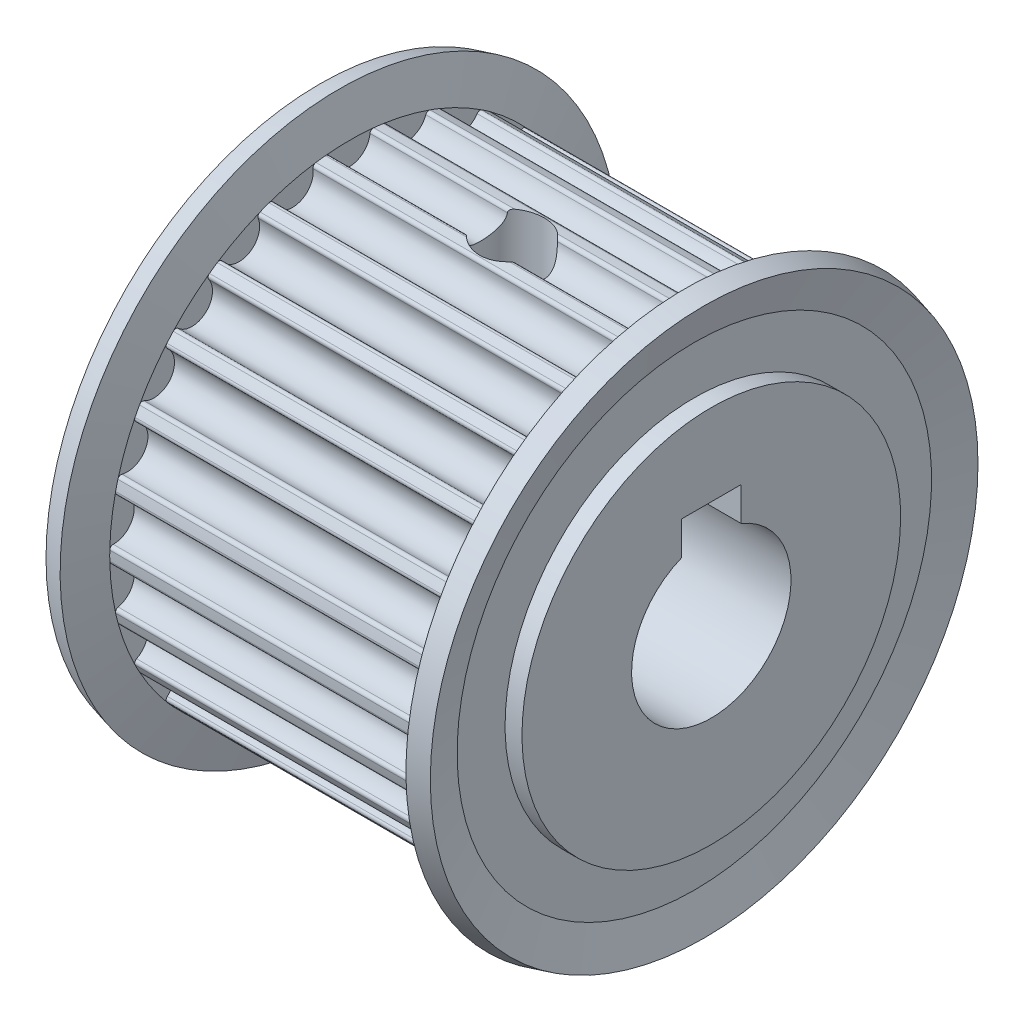
from build123d import *

# Parameters (mm, degrees)
CUT_EXTRUDE1_DEPTH       = 8.15
CUT_EXTRUDE1_DEPTH_BACK  = 8.15
CUT_EXTRUDE2_DEPTH       = 8.15
CUT_EXTRUDE2_DEPTH_BACK  = 8.15
CUT_EXTRUDE3_DEPTH       = 8.15
CUT_EXTRUDE3_DEPTH_BACK  = 8.15
CUT_EXTRUDE4_DEPTH       = 8.15
CUT_EXTRUDE4_DEPTH_BACK  = 8.15
CUT_EXTRUDE5_DEPTH       = 8.15
CUT_EXTRUDE5_DEPTH_BACK  = 8.15
CUT_EXTRUDE6_DEPTH       = 8.15
CUT_EXTRUDE6_DEPTH_BACK  = 8.15
CUT_EXTRUDE7_DEPTH       = 8.15
CUT_EXTRUDE7_DEPTH_BACK  = 8.15
CUT_EXTRUDE8_DEPTH       = 8.15
CUT_EXTRUDE8_DEPTH_BACK  = 8.15
CUT_EXTRUDE9_DEPTH       = 8.15
CUT_EXTRUDE9_DEPTH_BACK  = 8.15
CUT_EXTRUDE10_DEPTH      = 8.15
CUT_EXTRUDE10_DEPTH_BACK = 8.15
CUT_EXTRUDE11_DEPTH      = 8.15
CUT_EXTRUDE11_DEPTH_BACK = 8.15
CUT_EXTRUDE12_DEPTH      = 8.15
CUT_EXTRUDE12_DEPTH_BACK = 8.15
CUT_EXTRUDE13_DEPTH      = 8.15
CUT_EXTRUDE13_DEPTH_BACK = 8.15
CUT_EXTRUDE14_DEPTH      = 8.15
CUT_EXTRUDE14_DEPTH_BACK = 8.15
CUT_EXTRUDE15_DEPTH      = 8.15
CUT_EXTRUDE15_DEPTH_BACK = 8.15
CUT_EXTRUDE16_DEPTH      = 8.15
CUT_EXTRUDE16_DEPTH_BACK = 8.15
CUT_EXTRUDE17_DEPTH      = 8.15
CUT_EXTRUDE17_DEPTH_BACK = 8.15
CUT_EXTRUDE18_DEPTH      = 8.15
CUT_EXTRUDE18_DEPTH_BACK = 8.15
CUT_EXTRUDE19_DEPTH      = 8.15
CUT_EXTRUDE19_DEPTH_BACK = 8.15
CUT_EXTRUDE20_DEPTH      = 8.15
CUT_EXTRUDE20_DEPTH_BACK = 8.15
CUT_EXTRUDE21_DEPTH      = 8.15
CUT_EXTRUDE21_DEPTH_BACK = 8.15
CUT_EXTRUDE22_DEPTH      = 8.15
CUT_EXTRUDE22_DEPTH_BACK = 8.15
CUT_EXTRUDE23_DEPTH      = 8.15
CUT_EXTRUDE23_DEPTH_BACK = 8.15
CUT_EXTRUDE24_DEPTH      = 8.15
CUT_EXTRUDE24_DEPTH_BACK = 8.15
CUT_EXTRUDE25_DEPTH      = 8.15
CUT_EXTRUDE25_DEPTH_BACK = 8.15
CUT_EXTRUDE26_DEPTH      = 8.15
CUT_EXTRUDE26_DEPTH_BACK = 8.15
SKETCH28_W               = 20
SKETCH28_H               = 4
SKETCH29_W               = 1.621
SKETCH29_H               = 12.035
SKETCH31_W               = 3
SKETCH31_H               = 5.4
CUT_EXTRUDE27_DEPTH      = 20


with BuildPart() as part:
    # Sketch1 → Revolve1 (revolve)
    with BuildSketch(Plane.XY, mode=Mode.PRIVATE) as revolve1_sk:
        Polygon((0, 0), (0, 9.5), (0.85, 9.5), (0.85, 11.903347502), (0.357554011, 13.741180955), (1.323479837, 14), (1.85, 12.035), (18.15, 12.035), (18.676520163, 14), (19.642445989, 13.741180955), (19.15, 11.903347502), (19.15, 9.5), (20, 9.5), (20, 0), align=None)
    revolve(revolve1_sk.sketch.rotate(Axis((20, 0, 0), (-1, 0, 0)), 180), axis=Axis((20, 0, 0), (-1, 0, 0)))

    # Sketch2 → Cut-Extrude1 (cut, two sides: drawn at the far end of the back side and taken through both)
    with BuildSketch(Plane(origin=(10, 0, 0), x_dir=(0, 0, -1), z_dir=(1, 0, 0)).offset(-CUT_EXTRUDE1_DEPTH_BACK)):
        with BuildLine():
            Line((-1.249308054, 12.3519818), (-1.211069064, 11.97391067))
            ThreePointArc((-1.211069064, 11.97391067), (-1.086431486, 11.936444223), (-1.024817519, 11.821805749))
            ThreePointArc((-1.024817519, 11.821805749), (1e-09, 10.895), (1.024817519, 11.821805751))
            ThreePointArc((1.024817519, 11.821805751), (1.086431486, 11.936444223), (1.211069064, 11.97391067))
            Line((1.211069064, 11.97391067), (1.249308054, 12.3519818))
            ThreePointArc((1.249308054, 12.3519818), (0, 12.415), (-1.249308054, 12.3519818))
        make_face()
    extrude(amount=CUT_EXTRUDE1_DEPTH + CUT_EXTRUDE1_DEPTH_BACK, mode=Mode.SUBTRACT)

    # Sketch3 → Cut-Extrude2 (cut, two sides: drawn at the far end of the back side and taken through both)
    with BuildSketch(Plane(origin=(10, 0, 0), x_dir=(0, 0, -1), z_dir=(1, 0, 0)).offset(-CUT_EXTRUDE2_DEPTH_BACK)):
        with BuildLine():
            Line((-4.169028162, 11.694076671), (-4.041421984, 11.33614279))
            ThreePointArc((-4.041421984, 11.33614279), (-3.91143984, 11.329592774), (-3.82418148, 11.233030674))
            ThreePointArc((-3.82418148, 11.233030674), (-2.607344162, 10.578411101), (-1.834105112, 11.723540446))
            ThreePointArc((-1.834105112, 11.723540446), (-1.801716317, 11.84959292), (-1.689666788, 11.915798385))
            Line((-1.689666788, 11.915798385), (-1.743017297, 12.292034644))
            ThreePointArc((-1.743017297, 12.292034644), (-2.971103972, 12.054242663), (-4.169028162, 11.694076671))
        make_face()
    extrude(amount=CUT_EXTRUDE2_DEPTH + CUT_EXTRUDE2_DEPTH_BACK, mode=Mode.SUBTRACT)

    # Sketch4 → Cut-Extrude3 (cut, two sides: drawn at the far end of the back side and taken through both)
    with BuildSketch(Plane(origin=(10, 0, 0), x_dir=(0, 0, -1), z_dir=(1, 0, 0)).offset(-CUT_EXTRUDE3_DEPTH_BACK)):
        with BuildLine():
            Line((-6.846459507, 10.356554312), (-6.636902148, 10.039559496))
            ThreePointArc((-6.636902148, 10.039559496), (-6.509129527, 10.064306575), (-6.401297914, 9.991432686))
            ThreePointArc((-6.401297914, 9.991432686), (-5.063158959, 9.6470434), (-4.58643622, 10.943945584))
            ThreePointArc((-4.58643622, 10.943945584), (-4.585154916, 11.074086349), (-4.492205348, 11.16518321))
            Line((-4.492205348, 11.16518321), (-4.634044819, 11.517719115))
            ThreePointArc((-4.634044819, 11.517719115), (-5.769538181, 10.992936558), (-6.846459507, 10.356554312))
        make_face()
    extrude(amount=CUT_EXTRUDE3_DEPTH + CUT_EXTRUDE3_DEPTH_BACK, mode=Mode.SUBTRACT)

    # Sketch5 → Cut-Extrude4 (cut, two sides: drawn at the far end of the back side and taken through both)
    with BuildSketch(Plane(origin=(10, 0, 0), x_dir=(0, 0, -1), z_dir=(1, 0, 0)).offset(-CUT_EXTRUDE4_DEPTH_BACK)):
        with BuildLine():
            Line((-9.125999512, 8.417146661), (-8.846669684, 8.159513497))
            ThreePointArc((-8.846669684, 8.159513497), (-8.728532267, 8.214119461), (-8.606394181, 8.169168949))
            ThreePointArc((-8.606394181, 8.169168949), (-7.224721361, 8.155024602), (-7.072220327, 9.528328384))
            ThreePointArc((-7.072220327, 9.528328384), (-7.102120978, 9.654994131), (-7.033673262, 9.765688171))
            Line((-7.033673262, 9.765688171), (-7.2557585, 10.074035616))
            ThreePointArc((-7.2557585, 10.074035616), (-8.232667802, 9.292760939), (-9.125999512, 8.417146661))
        make_face()
    extrude(amount=CUT_EXTRUDE4_DEPTH + CUT_EXTRUDE4_DEPTH_BACK, mode=Mode.SUBTRACT)

    # Sketch6 → Cut-Extrude5 (cut, two sides: drawn at the far end of the back side and taken through both)
    with BuildSketch(Plane(origin=(10, 0, 0), x_dir=(0, 0, -1), z_dir=(1, 0, 0)).offset(-CUT_EXTRUDE5_DEPTH_BACK)):
        with BuildLine():
            Line((-10.875169596, 5.988565041), (-10.542300934, 5.805266232))
            ThreePointArc((-10.542300934, 5.805266232), (-10.440664438, 5.88655758), (-10.311318101, 5.872142805))
            ThreePointArc((-10.311318101, 5.872142805), (-8.966409218, 6.189065416), (-9.146992694, 7.558959373))
            ThreePointArc((-9.146992694, 7.558959373), (-9.206337585, 7.674788749), (-9.166369652, 7.798646832))
            Line((-9.166369652, 7.798646832), (-9.45579387, 8.044885785))
            ThreePointArc((-9.45579387, 8.044885785), (-10.217344695, 7.052523831), (-10.875169596, 5.988565041))
        make_face()
    extrude(amount=CUT_EXTRUDE5_DEPTH + CUT_EXTRUDE5_DEPTH_BACK, mode=Mode.SUBTRACT)

    # Sketch7 → Cut-Extrude6 (cut, two sides: drawn at the far end of the back side and taken through both)
    with BuildSketch(Plane(origin=(10, 0, 0), x_dir=(0, 0, -1), z_dir=(1, 0, 0)).offset(-CUT_EXTRUDE6_DEPTH_BACK)):
        with BuildLine():
            Line((-11.992314354, 3.211949789), (-11.625251973, 3.113637995))
            ThreePointArc((-11.625251973, 3.113637995), (-11.546023142, 3.21689037), (-11.416985694, 3.233849067))
            ThreePointArc((-11.416985694, 3.233849067), (-10.187001964, 3.863420245), (-10.690175094, 5.150291119))
            ThreePointArc((-10.690175094, 5.150291119), (-10.775515314, 5.248552542), (-10.766349956, 5.378376486))
            Line((-10.766349956, 5.378376486), (-11.106292871, 5.548196433))
            ThreePointArc((-11.106292871, 5.548196433), (-11.608226653, 4.402419673), (-11.992314354, 3.211949789))
        make_face()
    extrude(amount=CUT_EXTRUDE6_DEPTH + CUT_EXTRUDE6_DEPTH_BACK, mode=Mode.SUBTRACT)

    # Sketch8 → Cut-Extrude7 (cut, two sides: drawn at the far end of the back side and taken through both)
    with BuildSketch(Plane(origin=(10, 0, 0), x_dir=(0, 0, -1), z_dir=(1, 0, 0)).offset(-CUT_EXTRUDE7_DEPTH_BACK)):
        with BuildLine():
            Line((-12.412509391, 0.248667689), (-12.032585624, 0.241056435))
            ThreePointArc((-12.032585624, 0.241056435), (-11.980368949, 0.360269184), (-11.859139576, 0.407615774))
            ThreePointArc((-11.859139576, 0.407615774), (-10.815563183, 1.313247132), (-11.612083375, 2.442306665))
            ThreePointArc((-11.612083375, 2.442306665), (-11.718459261, 2.517289538), (-11.740629135, 2.645534449))
            Line((-11.740629135, 2.645534449), (-12.1113345, 2.729066072))
            ThreePointArc((-12.1113345, 2.729066072), (-12.324480672, 1.496462885), (-12.412509391, 0.248667689))
        make_face()
    extrude(amount=CUT_EXTRUDE7_DEPTH + CUT_EXTRUDE7_DEPTH_BACK, mode=Mode.SUBTRACT)

    # Sketch9 → Cut-Extrude8 (cut, two sides: drawn at the far end of the back side and taken through both)
    with BuildSketch(Plane(origin=(10, 0, 0), x_dir=(0, 0, -1), z_dir=(1, 0, 0)).offset(-CUT_EXTRUDE8_DEPTH_BACK)):
        with BuildLine():
            Line((-12.1113345, -2.729066072), (-11.740629135, -2.645534449))
            ThreePointArc((-11.740629135, -2.645534449), (-11.71845926, -2.517289538), (-11.612083373, -2.442306665))
            ThreePointArc((-11.612083373, -2.442306665), (-10.815563183, -1.313247131), (-11.859139578, -0.407615775))
            ThreePointArc((-11.859139578, -0.407615775), (-11.98036895, -0.360269183), (-12.032585624, -0.241056435))
            Line((-12.032585624, -0.241056435), (-12.412509391, -0.248667689))
            ThreePointArc((-12.412509391, -0.248667689), (-12.324480672, -1.496462885), (-12.1113345, -2.729066072))
        make_face()
    extrude(amount=CUT_EXTRUDE8_DEPTH + CUT_EXTRUDE8_DEPTH_BACK, mode=Mode.SUBTRACT)

    # Sketch10 → Cut-Extrude9 (cut, two sides: drawn at the far end of the back side and taken through both)
    with BuildSketch(Plane(origin=(10, 0, 0), x_dir=(0, 0, -1), z_dir=(1, 0, 0)).offset(-CUT_EXTRUDE9_DEPTH_BACK)):
        with BuildLine():
            Line((-11.106292871, -5.548196433), (-10.766349956, -5.378376486))
            ThreePointArc((-10.766349956, -5.378376486), (-10.775515314, -5.248552541), (-10.690175093, -5.150291118))
            ThreePointArc((-10.690175093, -5.150291118), (-10.187001964, -3.863420244), (-11.416985695, -3.233849067))
            ThreePointArc((-11.416985695, -3.233849067), (-11.546023143, -3.216890369), (-11.625251973, -3.113637995))
            Line((-11.625251973, -3.113637995), (-11.992314354, -3.211949789))
            ThreePointArc((-11.992314354, -3.211949789), (-11.608226653, -4.402419673), (-11.106292871, -5.548196433))
        make_face()
    extrude(amount=CUT_EXTRUDE9_DEPTH + CUT_EXTRUDE9_DEPTH_BACK, mode=Mode.SUBTRACT)

    # Sketch11 → Cut-Extrude10 (cut, two sides: drawn at the far end of the back side and taken through both)
    with BuildSketch(Plane(origin=(10, 0, 0), x_dir=(0, 0, -1), z_dir=(1, 0, 0)).offset(-CUT_EXTRUDE10_DEPTH_BACK)):
        with BuildLine():
            Line((-9.45579387, -8.044885785), (-9.166369652, -7.798646832))
            ThreePointArc((-9.166369652, -7.798646832), (-9.206337585, -7.674788748), (-9.146992693, -7.558959372))
            ThreePointArc((-9.146992693, -7.558959372), (-8.966409219, -6.189065415), (-10.311318103, -5.872142806))
            ThreePointArc((-10.311318103, -5.872142806), (-10.440664439, -5.88655758), (-10.542300934, -5.805266232))
            Line((-10.542300934, -5.805266232), (-10.875169596, -5.988565041))
            ThreePointArc((-10.875169596, -5.988565041), (-10.217344695, -7.052523831), (-9.45579387, -8.044885785))
        make_face()
    extrude(amount=CUT_EXTRUDE10_DEPTH + CUT_EXTRUDE10_DEPTH_BACK, mode=Mode.SUBTRACT)

    # Sketch12 → Cut-Extrude11 (cut, two sides: drawn at the far end of the back side and taken through both)
    with BuildSketch(Plane(origin=(10, 0, 0), x_dir=(0, 0, -1), z_dir=(1, 0, 0)).offset(-CUT_EXTRUDE11_DEPTH_BACK)):
        with BuildLine():
            Line((-7.2557585, -10.074035616), (-7.033673262, -9.765688171))
            ThreePointArc((-7.033673262, -9.765688171), (-7.102120979, -9.65499413), (-7.072220326, -9.528328383))
            ThreePointArc((-7.072220326, -9.528328383), (-7.224721362, -8.155024601), (-8.606394182, -8.16916895))
            ThreePointArc((-8.606394182, -8.16916895), (-8.728532268, -8.214119461), (-8.846669684, -8.159513497))
            Line((-8.846669684, -8.159513497), (-9.125999512, -8.417146661))
            ThreePointArc((-9.125999512, -8.417146661), (-8.232667802, -9.292760939), (-7.2557585, -10.074035616))
        make_face()
    extrude(amount=CUT_EXTRUDE11_DEPTH + CUT_EXTRUDE11_DEPTH_BACK, mode=Mode.SUBTRACT)

    # Sketch13 → Cut-Extrude12 (cut, two sides: drawn at the far end of the back side and taken through both)
    with BuildSketch(Plane(origin=(10, 0, 0), x_dir=(0, 0, -1), z_dir=(1, 0, 0)).offset(-CUT_EXTRUDE12_DEPTH_BACK)):
        with BuildLine():
            Line((-4.634044819, -11.517719115), (-4.492205348, -11.16518321))
            ThreePointArc((-4.492205348, -11.16518321), (-4.585154917, -11.074086348), (-4.58643622, -10.943945583))
            ThreePointArc((-4.58643622, -10.943945583), (-5.06315896, -9.647043399), (-6.401297915, -9.991432688))
            ThreePointArc((-6.401297915, -9.991432688), (-6.509129528, -10.064306576), (-6.636902148, -10.039559496))
            Line((-6.636902148, -10.039559496), (-6.846459507, -10.356554312))
            ThreePointArc((-6.846459507, -10.356554312), (-5.769538181, -10.992936558), (-4.634044819, -11.517719115))
        make_face()
    extrude(amount=CUT_EXTRUDE12_DEPTH + CUT_EXTRUDE12_DEPTH_BACK, mode=Mode.SUBTRACT)

    # Sketch14 → Cut-Extrude13 (cut, two sides: drawn at the far end of the back side and taken through both)
    with BuildSketch(Plane(origin=(10, 0, 0), x_dir=(0, 0, -1), z_dir=(1, 0, 0)).offset(-CUT_EXTRUDE13_DEPTH_BACK)):
        with BuildLine():
            Line((-1.743017297, -12.292034644), (-1.689666788, -11.915798385))
            ThreePointArc((-1.689666788, -11.915798385), (-1.801716317, -11.84959292), (-1.834105112, -11.723540444))
            ThreePointArc((-1.834105112, -11.723540444), (-2.607344163, -10.578411101), (-3.824181481, -11.233030675))
            ThreePointArc((-3.824181481, -11.233030675), (-3.91143984, -11.329592775), (-4.041421984, -11.33614279))
            Line((-4.041421984, -11.33614279), (-4.169028162, -11.694076671))
            ThreePointArc((-4.169028162, -11.694076671), (-2.971103972, -12.054242663), (-1.743017297, -12.292034644))
        make_face()
    extrude(amount=CUT_EXTRUDE13_DEPTH + CUT_EXTRUDE13_DEPTH_BACK, mode=Mode.SUBTRACT)

    # Sketch15 → Cut-Extrude14 (cut, two sides: drawn at the far end of the back side and taken through both)
    with BuildSketch(Plane(origin=(10, 0, 0), x_dir=(0, 0, -1), z_dir=(1, 0, 0)).offset(-CUT_EXTRUDE14_DEPTH_BACK)):
        with BuildLine():
            Line((1.249308054, -12.3519818), (1.211069064, -11.97391067))
            ThreePointArc((1.211069064, -11.97391067), (1.086431486, -11.936444223), (1.024817519, -11.821805749))
            ThreePointArc((1.024817519, -11.821805749), (-1e-09, -10.895), (-1.024817519, -11.821805751))
            ThreePointArc((-1.024817519, -11.821805751), (-1.086431486, -11.936444223), (-1.211069064, -11.97391067))
            Line((-1.211069064, -11.97391067), (-1.249308054, -12.3519818))
            ThreePointArc((-1.249308054, -12.3519818), (0, -12.415), (1.249308054, -12.3519818))
        make_face()
    extrude(amount=CUT_EXTRUDE14_DEPTH + CUT_EXTRUDE14_DEPTH_BACK, mode=Mode.SUBTRACT)

    # Sketch16 → Cut-Extrude15 (cut, two sides: drawn at the far end of the back side and taken through both)
    with BuildSketch(Plane(origin=(10, 0, 0), x_dir=(0, 0, -1), z_dir=(1, 0, 0)).offset(-CUT_EXTRUDE15_DEPTH_BACK)):
        with BuildLine():
            Line((4.169028162, -11.694076671), (4.041421984, -11.33614279))
            ThreePointArc((4.041421984, -11.33614279), (3.91143984, -11.329592774), (3.82418148, -11.233030674))
            ThreePointArc((3.82418148, -11.233030674), (2.607344162, -10.578411101), (1.834105112, -11.723540446))
            ThreePointArc((1.834105112, -11.723540446), (1.801716317, -11.84959292), (1.689666788, -11.915798385))
            Line((1.689666788, -11.915798385), (1.743017297, -12.292034644))
            ThreePointArc((1.743017297, -12.292034644), (2.971103972, -12.054242663), (4.169028162, -11.694076671))
        make_face()
    extrude(amount=CUT_EXTRUDE15_DEPTH + CUT_EXTRUDE15_DEPTH_BACK, mode=Mode.SUBTRACT)

    # Sketch17 → Cut-Extrude16 (cut, two sides: drawn at the far end of the back side and taken through both)
    with BuildSketch(Plane(origin=(10, 0, 0), x_dir=(0, 0, -1), z_dir=(1, 0, 0)).offset(-CUT_EXTRUDE16_DEPTH_BACK)):
        with BuildLine():
            Line((6.846459507, -10.356554312), (6.636902148, -10.039559496))
            ThreePointArc((6.636902148, -10.039559496), (6.509129527, -10.064306575), (6.401297914, -9.991432686))
            ThreePointArc((6.401297914, -9.991432686), (5.063158959, -9.6470434), (4.58643622, -10.943945584))
            ThreePointArc((4.58643622, -10.943945584), (4.585154916, -11.074086349), (4.492205348, -11.16518321))
            Line((4.492205348, -11.16518321), (4.634044819, -11.517719115))
            ThreePointArc((4.634044819, -11.517719115), (5.769538181, -10.992936558), (6.846459507, -10.356554312))
        make_face()
    extrude(amount=CUT_EXTRUDE16_DEPTH + CUT_EXTRUDE16_DEPTH_BACK, mode=Mode.SUBTRACT)

    # Sketch18 → Cut-Extrude17 (cut, two sides: drawn at the far end of the back side and taken through both)
    with BuildSketch(Plane(origin=(10, 0, 0), x_dir=(0, 0, -1), z_dir=(1, 0, 0)).offset(-CUT_EXTRUDE17_DEPTH_BACK)):
        with BuildLine():
            Line((9.125999512, -8.417146661), (8.846669684, -8.159513497))
            ThreePointArc((8.846669684, -8.159513497), (8.728532267, -8.214119461), (8.606394181, -8.169168949))
            ThreePointArc((8.606394181, -8.169168949), (7.224721361, -8.155024602), (7.072220327, -9.528328384))
            ThreePointArc((7.072220327, -9.528328384), (7.102120978, -9.654994131), (7.033673262, -9.765688171))
            Line((7.033673262, -9.765688171), (7.2557585, -10.074035616))
            ThreePointArc((7.2557585, -10.074035616), (8.232667802, -9.292760939), (9.125999512, -8.417146661))
        make_face()
    extrude(amount=CUT_EXTRUDE17_DEPTH + CUT_EXTRUDE17_DEPTH_BACK, mode=Mode.SUBTRACT)

    # Sketch19 → Cut-Extrude18 (cut, two sides: drawn at the far end of the back side and taken through both)
    with BuildSketch(Plane(origin=(10, 0, 0), x_dir=(0, 0, -1), z_dir=(1, 0, 0)).offset(-CUT_EXTRUDE18_DEPTH_BACK)):
        with BuildLine():
            Line((10.875169596, -5.988565041), (10.542300934, -5.805266232))
            ThreePointArc((10.542300934, -5.805266232), (10.440664438, -5.88655758), (10.311318101, -5.872142805))
            ThreePointArc((10.311318101, -5.872142805), (8.966409218, -6.189065416), (9.146992694, -7.558959373))
            ThreePointArc((9.146992694, -7.558959373), (9.206337585, -7.674788749), (9.166369652, -7.798646832))
            Line((9.166369652, -7.798646832), (9.45579387, -8.044885785))
            ThreePointArc((9.45579387, -8.044885785), (10.217344695, -7.052523831), (10.875169596, -5.988565041))
        make_face()
    extrude(amount=CUT_EXTRUDE18_DEPTH + CUT_EXTRUDE18_DEPTH_BACK, mode=Mode.SUBTRACT)

    # Sketch20 → Cut-Extrude19 (cut, two sides: drawn at the far end of the back side and taken through both)
    with BuildSketch(Plane(origin=(10, 0, 0), x_dir=(0, 0, -1), z_dir=(1, 0, 0)).offset(-CUT_EXTRUDE19_DEPTH_BACK)):
        with BuildLine():
            Line((11.992314354, -3.211949789), (11.625251973, -3.113637995))
            ThreePointArc((11.625251973, -3.113637995), (11.546023142, -3.21689037), (11.416985694, -3.233849067))
            ThreePointArc((11.416985694, -3.233849067), (10.187001964, -3.863420245), (10.690175094, -5.150291119))
            ThreePointArc((10.690175094, -5.150291119), (10.775515314, -5.248552542), (10.766349956, -5.378376486))
            Line((10.766349956, -5.378376486), (11.106292871, -5.548196433))
            ThreePointArc((11.106292871, -5.548196433), (11.608226653, -4.402419673), (11.992314354, -3.211949789))
        make_face()
    extrude(amount=CUT_EXTRUDE19_DEPTH + CUT_EXTRUDE19_DEPTH_BACK, mode=Mode.SUBTRACT)

    # Sketch21 → Cut-Extrude20 (cut, two sides: drawn at the far end of the back side and taken through both)
    with BuildSketch(Plane(origin=(10, 0, 0), x_dir=(0, 0, -1), z_dir=(1, 0, 0)).offset(-CUT_EXTRUDE20_DEPTH_BACK)):
        with BuildLine():
            Line((12.412509391, -0.248667689), (12.032585624, -0.241056435))
            ThreePointArc((12.032585624, -0.241056435), (11.980368949, -0.360269184), (11.859139576, -0.407615774))
            ThreePointArc((11.859139576, -0.407615774), (10.815563183, -1.313247132), (11.612083375, -2.442306665))
            ThreePointArc((11.612083375, -2.442306665), (11.718459261, -2.517289538), (11.740629135, -2.645534449))
            Line((11.740629135, -2.645534449), (12.1113345, -2.729066072))
            ThreePointArc((12.1113345, -2.729066072), (12.324480672, -1.496462885), (12.412509391, -0.248667689))
        make_face()
    extrude(amount=CUT_EXTRUDE20_DEPTH + CUT_EXTRUDE20_DEPTH_BACK, mode=Mode.SUBTRACT)

    # Sketch22 → Cut-Extrude21 (cut, two sides: drawn at the far end of the back side and taken through both)
    with BuildSketch(Plane(origin=(10, 0, 0), x_dir=(0, 0, -1), z_dir=(1, 0, 0)).offset(-CUT_EXTRUDE21_DEPTH_BACK)):
        with BuildLine():
            Line((12.1113345, 2.729066072), (11.740629135, 2.645534449))
            ThreePointArc((11.740629135, 2.645534449), (11.71845926, 2.517289538), (11.612083373, 2.442306665))
            ThreePointArc((11.612083373, 2.442306665), (10.815563183, 1.313247131), (11.859139578, 0.407615775))
            ThreePointArc((11.859139578, 0.407615775), (11.98036895, 0.360269183), (12.032585624, 0.241056435))
            Line((12.032585624, 0.241056435), (12.412509391, 0.248667689))
            ThreePointArc((12.412509391, 0.248667689), (12.324480672, 1.496462885), (12.1113345, 2.729066072))
        make_face()
    extrude(amount=CUT_EXTRUDE21_DEPTH + CUT_EXTRUDE21_DEPTH_BACK, mode=Mode.SUBTRACT)

    # Sketch23 → Cut-Extrude22 (cut, two sides: drawn at the far end of the back side and taken through both)
    with BuildSketch(Plane(origin=(10, 0, 0), x_dir=(0, 0, -1), z_dir=(1, 0, 0)).offset(-CUT_EXTRUDE22_DEPTH_BACK)):
        with BuildLine():
            Line((11.106292871, 5.548196433), (10.766349956, 5.378376486))
            ThreePointArc((10.766349956, 5.378376486), (10.775515314, 5.248552541), (10.690175093, 5.150291118))
            ThreePointArc((10.690175093, 5.150291118), (10.187001964, 3.863420244), (11.416985695, 3.233849067))
            ThreePointArc((11.416985695, 3.233849067), (11.546023143, 3.216890369), (11.625251973, 3.113637995))
            Line((11.625251973, 3.113637995), (11.992314354, 3.211949789))
            ThreePointArc((11.992314354, 3.211949789), (11.608226653, 4.402419673), (11.106292871, 5.548196433))
        make_face()
    extrude(amount=CUT_EXTRUDE22_DEPTH + CUT_EXTRUDE22_DEPTH_BACK, mode=Mode.SUBTRACT)

    # Sketch24 → Cut-Extrude23 (cut, two sides: drawn at the far end of the back side and taken through both)
    with BuildSketch(Plane(origin=(10, 0, 0), x_dir=(0, 0, -1), z_dir=(1, 0, 0)).offset(-CUT_EXTRUDE23_DEPTH_BACK)):
        with BuildLine():
            Line((9.45579387, 8.044885785), (9.166369652, 7.798646832))
            ThreePointArc((9.166369652, 7.798646832), (9.206337585, 7.674788748), (9.146992693, 7.558959372))
            ThreePointArc((9.146992693, 7.558959372), (8.966409219, 6.189065415), (10.311318103, 5.872142806))
            ThreePointArc((10.311318103, 5.872142806), (10.440664439, 5.88655758), (10.542300934, 5.805266232))
            Line((10.542300934, 5.805266232), (10.875169596, 5.988565041))
            ThreePointArc((10.875169596, 5.988565041), (10.217344695, 7.052523831), (9.45579387, 8.044885785))
        make_face()
    extrude(amount=CUT_EXTRUDE23_DEPTH + CUT_EXTRUDE23_DEPTH_BACK, mode=Mode.SUBTRACT)

    # Sketch25 → Cut-Extrude24 (cut, two sides: drawn at the far end of the back side and taken through both)
    with BuildSketch(Plane(origin=(10, 0, 0), x_dir=(0, 0, -1), z_dir=(1, 0, 0)).offset(-CUT_EXTRUDE24_DEPTH_BACK)):
        with BuildLine():
            Line((7.2557585, 10.074035616), (7.033673262, 9.765688171))
            ThreePointArc((7.033673262, 9.765688171), (7.102120979, 9.65499413), (7.072220326, 9.528328383))
            ThreePointArc((7.072220326, 9.528328383), (7.224721362, 8.155024601), (8.606394182, 8.16916895))
            ThreePointArc((8.606394182, 8.16916895), (8.728532268, 8.214119461), (8.846669684, 8.159513497))
            Line((8.846669684, 8.159513497), (9.125999512, 8.417146661))
            ThreePointArc((9.125999512, 8.417146661), (8.232667802, 9.292760939), (7.2557585, 10.074035616))
        make_face()
    extrude(amount=CUT_EXTRUDE24_DEPTH + CUT_EXTRUDE24_DEPTH_BACK, mode=Mode.SUBTRACT)

    # Sketch26 → Cut-Extrude25 (cut, two sides: drawn at the far end of the back side and taken through both)
    with BuildSketch(Plane(origin=(10, 0, 0), x_dir=(0, 0, -1), z_dir=(1, 0, 0)).offset(-CUT_EXTRUDE25_DEPTH_BACK)):
        with BuildLine():
            Line((4.634044819, 11.517719115), (4.492205348, 11.16518321))
            ThreePointArc((4.492205348, 11.16518321), (4.585154917, 11.074086348), (4.58643622, 10.943945583))
            ThreePointArc((4.58643622, 10.943945583), (5.06315896, 9.647043399), (6.401297915, 9.991432688))
            ThreePointArc((6.401297915, 9.991432688), (6.509129528, 10.064306576), (6.636902148, 10.039559496))
            Line((6.636902148, 10.039559496), (6.846459507, 10.356554312))
            ThreePointArc((6.846459507, 10.356554312), (5.769538181, 10.992936558), (4.634044819, 11.517719115))
        make_face()
    extrude(amount=CUT_EXTRUDE25_DEPTH + CUT_EXTRUDE25_DEPTH_BACK, mode=Mode.SUBTRACT)

    # Sketch27 → Cut-Extrude26 (cut, two sides: drawn at the far end of the back side and taken through both)
    with BuildSketch(Plane(origin=(10, 0, 0), x_dir=(0, 0, -1), z_dir=(1, 0, 0)).offset(-CUT_EXTRUDE26_DEPTH_BACK)):
        with BuildLine():
            Line((1.743017297, 12.292034644), (1.689666788, 11.915798385))
            ThreePointArc((1.689666788, 11.915798385), (1.801716317, 11.84959292), (1.834105112, 11.723540444))
            ThreePointArc((1.834105112, 11.723540444), (2.607344163, 10.578411101), (3.824181481, 11.233030675))
            ThreePointArc((3.824181481, 11.233030675), (3.91143984, 11.329592775), (4.041421984, 11.33614279))
            Line((4.041421984, 11.33614279), (4.169028162, 11.694076671))
            ThreePointArc((4.169028162, 11.694076671), (2.971103972, 12.054242663), (1.743017297, 12.292034644))
        make_face()
    extrude(amount=CUT_EXTRUDE26_DEPTH + CUT_EXTRUDE26_DEPTH_BACK, mode=Mode.SUBTRACT)

    # Sketch28 → Cut-Revolve1 (revolve, cut)
    with BuildSketch(Plane.XY, mode=Mode.PRIVATE) as cut_revolve1_sk:
        with Locations((10, 2)):
            Rectangle(SKETCH28_W, SKETCH28_H)
    revolve(cut_revolve1_sk.sketch.rotate(Axis((20, 0, 0), (-1, 0, 0)), 354.224612318), axis=Axis((20, 0, 0), (-1, 0, 0)), mode=Mode.SUBTRACT)

    # Sketch29 → Cut-Revolve2 (revolve, cut)
    with BuildSketch(Plane(origin=(10, 0, 0), x_dir=(0, 0, -1), z_dir=(1, 0, 0)), mode=Mode.PRIVATE) as cut_revolve2_sk:
        with Locations((0.8105, 6.0175)):
            Rectangle(SKETCH29_W, SKETCH29_H)
    revolve(cut_revolve2_sk.sketch.rotate(Axis((10, 0, 0), (0, 1, 0)), 180), axis=Axis((10, 0, 0), (0, 1, 0)), mode=Mode.SUBTRACT)

    # Sketch30 → Cut-Revolve3 (revolve, cut)
    with BuildSketch(Plane(origin=(10, 0, 0), x_dir=(0, 0, -1), z_dir=(1, 0, 0)), mode=Mode.PRIVATE) as cut_revolve3_sk:
        Polygon((9.90461078, -6.836659293), (8.983777817, -8.170716134), (-0.920832963, -1.33405684), (0, 0), align=None)
    revolve(cut_revolve3_sk.sketch.rotate(Axis((10, 0, 0), (0, -0.5680647522556864, -0.8229838620803482)), 180), axis=Axis((10, 0, 0), (0, -0.5680647522556864, -0.8229838620803482)), mode=Mode.SUBTRACT)

    # Sketch31 → Cut-Extrude27 (cut)
    with BuildSketch(Plane(origin=(0, 0, 0), x_dir=(0, 0, -1), z_dir=(1, 0, 0))):
        with Locations((0, 2.7)):
            Rectangle(SKETCH31_W, SKETCH31_H)
    extrude(amount=CUT_EXTRUDE27_DEPTH, mode=Mode.SUBTRACT)


solid = part.part
